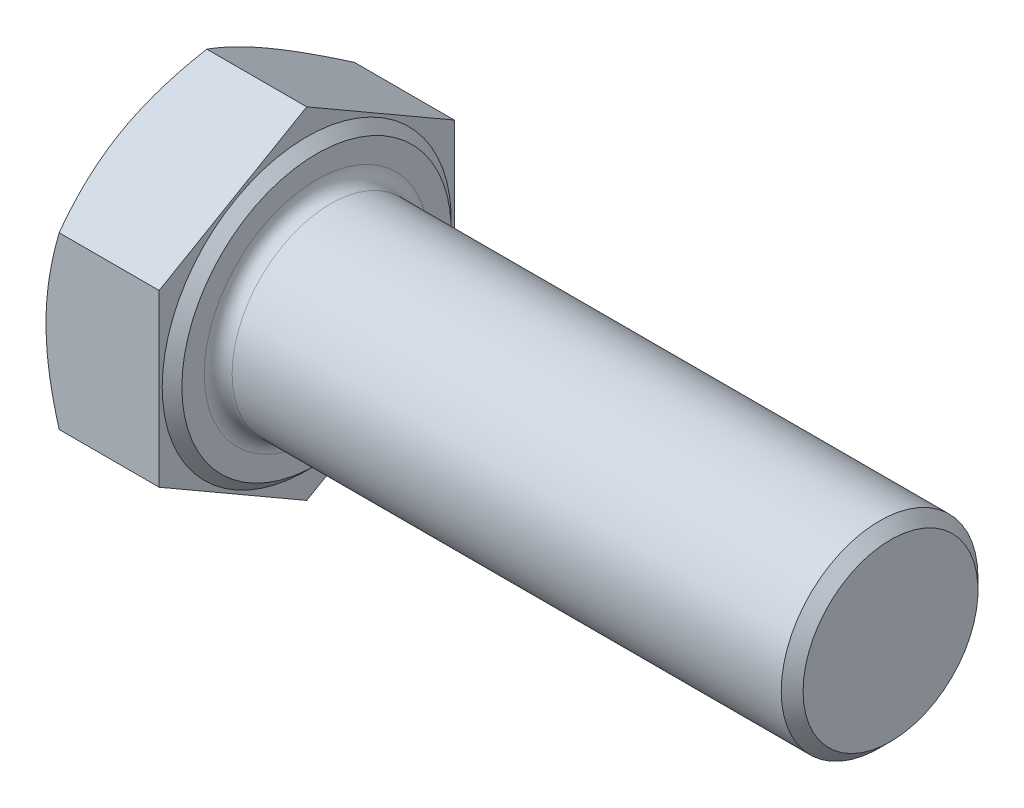
from build123d import *

# Parameters (mm, degrees)
EXTRUDE_1_DEPTH     = 7.5
SKETCH_4_R          = 20.03
SKETCH_4_R_2        = 9
CUT_EXTRUDE_1_DEPTH = 0.9375
CUT_EXTRUDE_1_DRAFT = -60
CHAMFER_2_SIZE      = 0.666666667


with BuildPart() as part:
    # 草图3 → 凸台-拉伸1 (new body)
    with BuildSketch(Plane(origin=(0, 0, 0), x_dir=(0, 0, -1), z_dir=(1, 0, 0))):
        Polygon((9, 5.196152423), (0, 10.392304845), (-9, 5.196152423), (-9, -5.196152423), (0, -10.392304845), (9, -5.196152423), align=None)
    extrude(amount=EXTRUDE_1_DEPTH)


with BuildPart() as cut_extrude_1_tool:
    # 草图4 → 切除-拉伸1 (with draft: the straight prism first)
    with BuildSketch(Plane.ZY):
        Circle(SKETCH_4_R)
        Circle(SKETCH_4_R_2, mode=Mode.SUBTRACT)
    extrude(amount=-CUT_EXTRUDE_1_DEPTH)
    # 切除-拉伸1: the draft: its side faces are tilted about the plane it starts from
    cut_extrude_1_sides = [cut_extrude_1_tool.faces().sort_by_distance(p)[0] for p in [
        (0.46875, 0, -20.03),
        (0.46875, 0, -9),
    ]]
    draft(cut_extrude_1_sides, Plane.ZY, CUT_EXTRUDE_1_DRAFT)


with BuildPart() as part_1:
    add(part.part)

    # 切除-拉伸1: cut by cut_extrude_1_tool
    add(cut_extrude_1_tool.part, mode=Mode.SUBTRACT)

    # 草图5 → 旋转1 (revolve)
    with BuildSketch(Plane.XY, mode=Mode.PRIVATE) as revolve_1_sk:
        with BuildLine():
            Line((8.35, 6), (42.5, 6))
            Line((42.5, 6), (42.5, 0))
            Line((42.5, 0), (7.5, 0))
            Line((7.5, 0), (7.5, 6.85))
            ThreePointArc((7.5, 6.85), (7.748959236, 6.248959236), (8.35, 6))
        make_face()
    revolve(revolve_1_sk.sketch.rotate(Axis((7.5, 0, 0), (1, 0, 0)), 90), axis=Axis((7.5, 0, 0), (1, 0, 0)))

    # 倒角2
    chamfer_2_edges = [part_1.edges().sort_by_distance(p)[0] for p in [
        (42.5, 0, -6),
    ]]
    chamfer(chamfer_2_edges, length=CHAMFER_2_SIZE)

    # 草图7 → 切除-旋转1 (revolve, cut)
    with BuildSketch(Plane.XY, mode=Mode.PRIVATE) as cut_revolve_1_sk:
        Polygon((7.5, 8.215), (6.9, 8.815), (6.9, 20.03), (7.5, 20.03), align=None)
    revolve(cut_revolve_1_sk.sketch.rotate(Axis((0, 0, 0), (1, 0, 0)), 90), axis=Axis((0, 0, 0), (1, 0, 0)), mode=Mode.SUBTRACT)


solid = part_1.part
